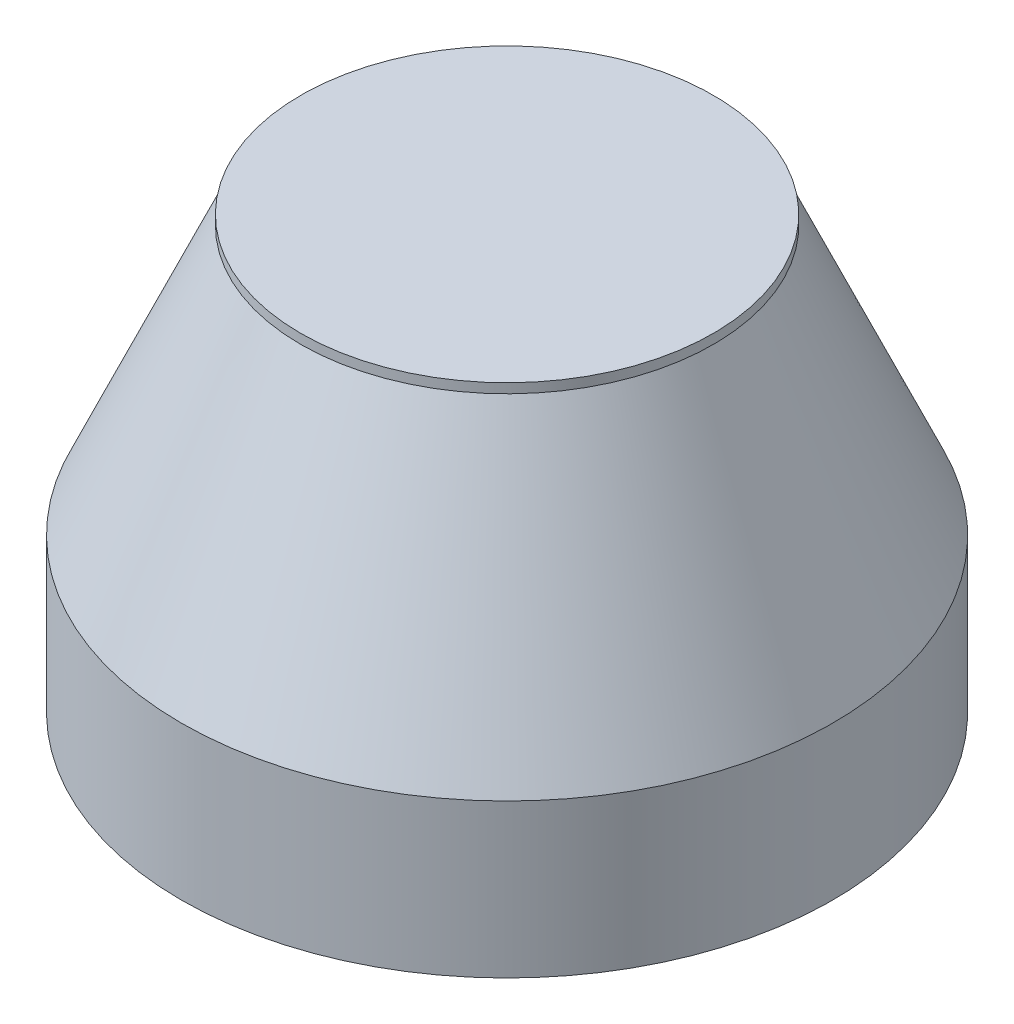
from build123d import *

# Parameters (mm, degrees)
SKETCH_1_R      = 17
EXTRUDE_1_DEPTH = 8
SKETCH_2_R      = 17
EXTRUDE_2_DEPTH = 14
EXTRUDE_2_TAPER = 24
SKETCH_4_R      = 10.766798406
EXTRUDE_3_DEPTH = 0.5


with BuildPart() as part:
    # 草图1 → 凸台-拉伸1 (new body)
    with BuildSketch(Plane(origin=(0, 0, 0), x_dir=(1, 0, 0), z_dir=(0, 1, 0))):
        with Locations(Location((0, 0, 0), (0, 0, 270))):
            Circle(SKETCH_1_R)
    extrude(amount=EXTRUDE_1_DEPTH)

    # 草图2 → 凸台-拉伸2 (add)
    with BuildSketch(Plane(origin=(0, 8, 0), x_dir=(1, 0, 0), z_dir=(0, 1, 0))):
        with Locations(Location((0, 0, 0), (0, 0, 270))):
            Circle(SKETCH_2_R)
    extrude(amount=EXTRUDE_2_DEPTH, taper=EXTRUDE_2_TAPER)

    # 草图4 → 凸台-拉伸3 (add)
    with BuildSketch(Plane(origin=(0, 22, 0), x_dir=(1, 0, 0), z_dir=(0, 1, 0))):
        with Locations(Location((0, 0, 0), (0, 0, 270))):
            Circle(SKETCH_4_R)
    extrude(amount=EXTRUDE_3_DEPTH)


solid = part.part
